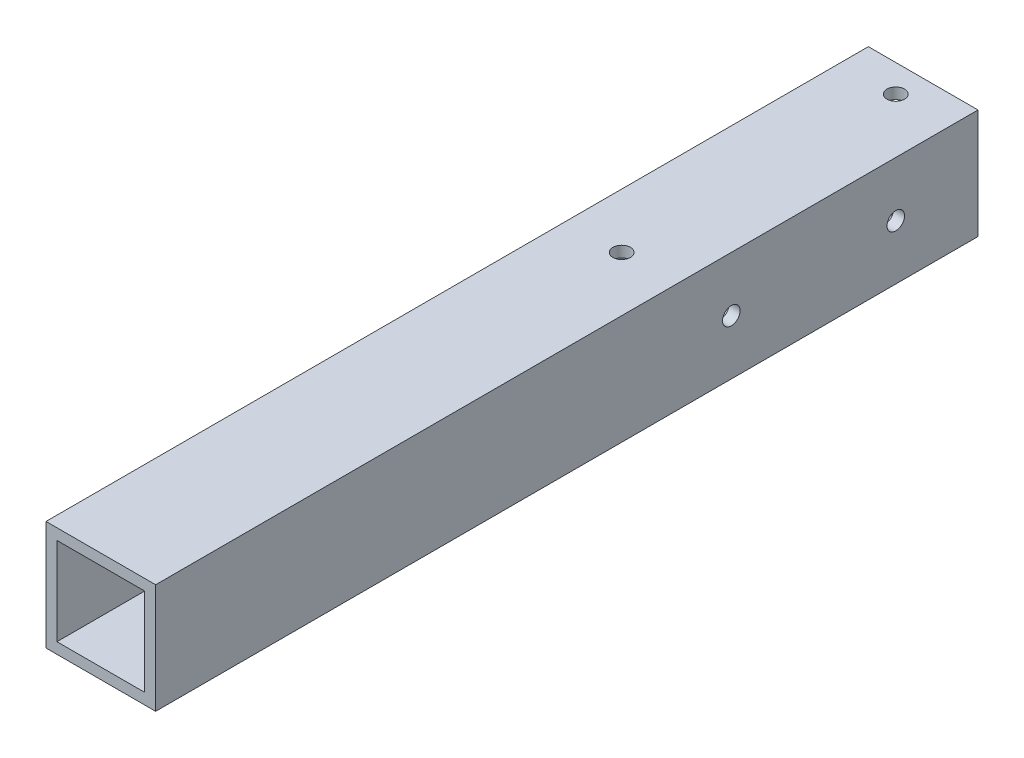
from build123d import *

# Parameters (mm, degrees)
SKETCH_1_W          = 20
SKETCH_1_H          = 20
SKETCH_1_W_2        = 16
SKETCH_1_H_2        = 16
EXTRUDE_1_DEPTH     = 150
SKETCH_2_R          = 1.6
CUT_EXTRUDE_1_DEPTH = 408.37168574
SKETCH_3_R          = 1.6
CUT_EXTRUDE_2_DEPTH = 10


with BuildPart() as part:
    # ｽｹｯﾁ1 → ﾎﾞｽ - 押し出し1 (new body)
    with BuildSketch(Plane.XY):
        Rectangle(SKETCH_1_W, SKETCH_1_H)
        Rectangle(SKETCH_1_W_2, SKETCH_1_H_2, mode=Mode.SUBTRACT)
    extrude(amount=EXTRUDE_1_DEPTH)

    # ｽｹｯﾁ2 → ｶｯﾄ - 押し出し1 (cut)
    with BuildSketch(Plane(origin=(0, 10, 0), x_dir=(1, 0, 0), z_dir=(0, 1, 0))):
        with Locations(Location((0, -5, 0), (0, 0, 270))):
            Circle(SKETCH_2_R)
        with Locations(Location((0, -55, 0), (0, 0, 270))):
            Circle(SKETCH_2_R)
    extrude(amount=-CUT_EXTRUDE_1_DEPTH, mode=Mode.SUBTRACT)

    # ｽｹｯﾁ3 → ｶｯﾄ - 押し出し2 (cut)
    with BuildSketch(Plane(origin=(10, 0, 0), x_dir=(0, 0, -1), z_dir=(1, 0, 0))):
        with Locations(Location((-15, 0, 0), (0, 0, 90))):
            Circle(SKETCH_3_R)
        with Locations(Location((-45, 0, 0), (0, 0, 90))):
            Circle(SKETCH_3_R)
    extrude(amount=-CUT_EXTRUDE_2_DEPTH, mode=Mode.SUBTRACT)


solid = part.part
